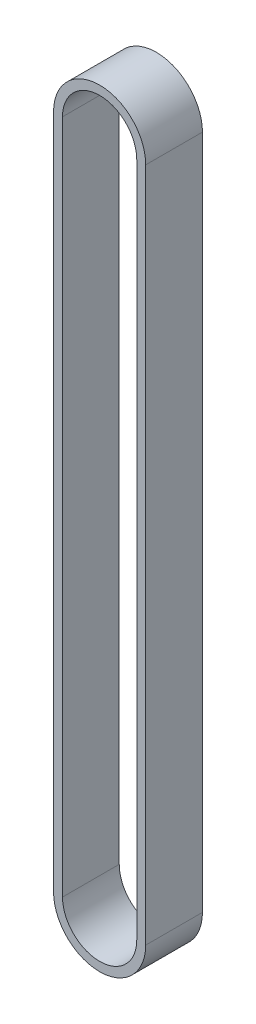
from build123d import *

# Parameters (mm, degrees)
BOSS_EXTRUDE1_DEPTH = 19


with BuildPart() as part:
    # Sketch1 → Boss-Extrude1 (new body)
    with BuildSketch(Plane.XY):
        with BuildLine():
            Line((-15.4333, -113.143764564), (-15.4333, 113.143764564))
            ThreePointArc((-15.4333, 113.143764564), (0, 128.577064564), (15.4333, 113.143764564))
            Line((15.4333, 113.143764564), (15.4333, -113.143764564))
            ThreePointArc((15.4333, -113.143764564), (0, -128.577064564), (-15.4333, -113.143764564))
        make_face()
        with BuildLine():
            Line((-12.4333, -113.143764564), (-12.4333, 113.143764564))
            ThreePointArc((-12.4333, 113.143764564), (0, 125.577064564), (12.4333, 113.143764564))
            Line((12.4333, 113.143764564), (12.4333, -113.143764564))
            ThreePointArc((12.4333, -113.143764564), (0, -125.577064564), (-12.4333, -113.143764564))
        make_face(mode=Mode.SUBTRACT)
    extrude(amount=BOSS_EXTRUDE1_DEPTH)


solid = part.part
